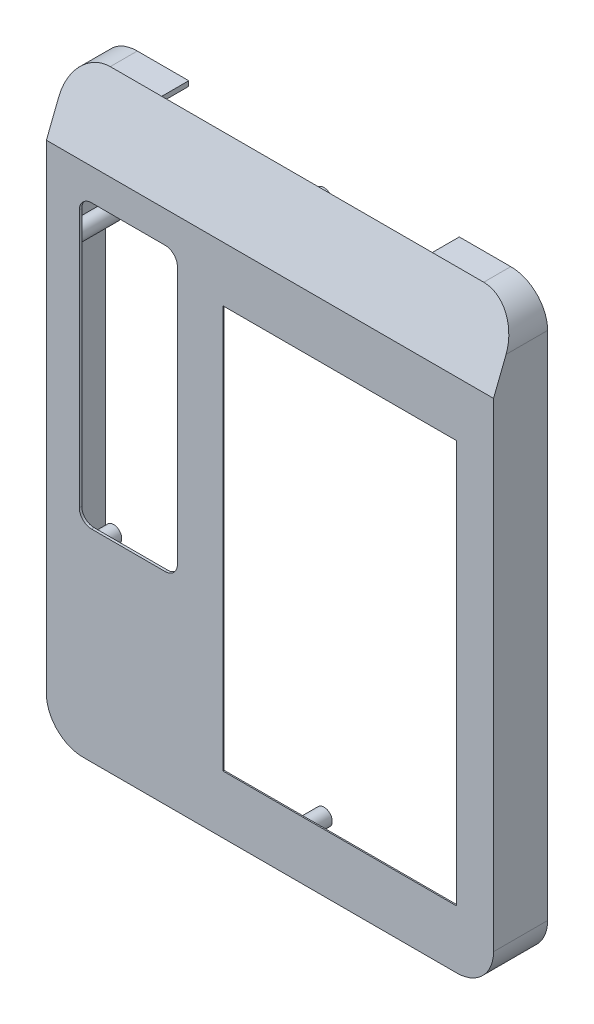
from build123d import *

# Parameters (mm, degrees)
BOSS_EXTRUDE1_DEPTH    = 22
CUT_EXTRUDE2_DEPTH     = 190.5
SHELL2_T               = -2
SKETCH5_R              = 3.35
BOSS_EXTRUDE7_DEPTH    = 20
BOSS_EXTRUDE8_REACH    = 153.413
SKETCH6_R              = 3.375
SKETCH6_R_2            = 3.3
SKETCH7_R              = 2
CUT_EXTRUDE3_DEPTH     = 4
SKETCH8_W              = 110.130223608
SKETCH8_H              = 11
CUT_EXTRUDE4_DEPTH     = 10
SKETCH9_R              = 3.325
BOSS_EXTRUDE10_DEPTH   = 20
BOSS_EXTRUDE10_2_DEPTH = 20
BOSS_EXTRUDE10_3_DEPTH = 20
BOSS_EXTRUDE10_4_DEPTH = 20
SKETCH10_R             = 2
CUT_EXTRUDE5_DEPTH     = 6
SKETCH12_W             = 95
SKETCH12_H             = 164
CUT_EXTRUDE6_DEPTH     = 10
SKETCH12_3_W           = 95
SKETCH12_3_H           = 164
CUT_EXTRUDE7_DEPTH     = 1.5
CUT_EXTRUDE8_DEPTH     = 10
CUT_EXTRUDE10_DEPTH    = 1
SKETCH14_R             = 0.9
BOSS_EXTRUDE11_DEPTH   = 4
SKETCH15_R             = 0.9
BOSS_EXTRUDE12_DEPTH   = 10


with BuildPart() as part:
    # Sketch1 → Boss-Extrude1 (new body)
    with BuildSketch(Plane.XY):
        with BuildLine():
            Line((-76, 119), (76, 119))
            ThreePointArc((76, 119), (86.606601718, 114.606601718), (91, 104))
            Line((91, 104), (91, -104))
            ThreePointArc((91, -104), (86.606601718, -114.606601718), (76, -119))
            Line((76, -119), (-76, -119))
            ThreePointArc((-76, -119), (-86.606601718, -114.606601718), (-91, -104))
            Line((-91, -104), (-91, 104))
            ThreePointArc((-91, 104), (-86.606601718, 114.606601718), (-76, 119))
        make_face()
    extrude(amount=BOSS_EXTRUDE1_DEPTH)

    # Sketch3 → Cut-Extrude2 (cut, symmetric)
    with BuildSketch(Plane.ZY.offset(91)):
        Polygon((11, 119), (22, 91.053283882), (22, 119), align=None)
    extrude(amount=CUT_EXTRUDE2_DEPTH, both=True, mode=Mode.SUBTRACT)

    # Shell2
    shell2_openings = [part.faces().sort_by_distance(p)[0] for p in [
        (0, 0, 0),
    ]]
    offset(amount=SHELL2_T, openings=shell2_openings, kind=Kind.INTERSECTION)

    # Sketch5 → Boss-Extrude7 (add)
    with BuildSketch(Plane(origin=(0, 0, 20), x_dir=(-1, 0, 0), z_dir=(0, 0, -1))):
        with Locations(Location((0, -112.875, 0), (0, 0, 180))):
            Circle(SKETCH5_R)
        with Locations(Location((-82.275572683, -110.275572683, 0), (0, 0, 180))):
            Circle(SKETCH5_R)
        with Locations(Location((82.275572683, -110.275572683, 0), (0, 0, 180))):
            Circle(SKETCH5_R)
    extrude(amount=BOSS_EXTRUDE7_DEPTH)

    # Boss-Extrude8: up to this plane
    boss_extrude8_end = Plane(origin=(99.5, 118.267487817, 9.138971816), z_dir=(0, -0.3662560913903144, -0.9305140920585189))
    # Sketch6 → Boss-Extrude8 (add, up to the surface)
    with BuildSketch(Plane(origin=(0, 0, 0), x_dir=(-1, 0, 0), z_dir=(0, 0, -1)), mode=Mode.PRIVATE) as boss_extrude8_sk1:
        with Locations((0, 105.5)):
            Circle(SKETCH6_R)
    boss_extrude8_tool1 = split(extrude(boss_extrude8_sk1.sketch, amount=-BOSS_EXTRUDE8_REACH, mode=Mode.PRIVATE), bisect_by=boss_extrude8_end, keep=Keep.BOTH, mode=Mode.PRIVATE)
    add(boss_extrude8_tool1.solids().sort_by_distance((0, 105.5, 0))[0])
    # Sketch6 → Boss-Extrude8 (add, up to the surface)
    with BuildSketch(Plane(origin=(0, 0, 0), x_dir=(-1, 0, 0), z_dir=(0, 0, -1)), mode=Mode.PRIVATE) as boss_extrude8_sk2:
        with Locations((-81.833630945, 109.833630945)):
            Circle(SKETCH6_R_2)
    boss_extrude8_tool2 = split(extrude(boss_extrude8_sk2.sketch, amount=-BOSS_EXTRUDE8_REACH, mode=Mode.PRIVATE), bisect_by=boss_extrude8_end, keep=Keep.BOTH, mode=Mode.PRIVATE)
    add(boss_extrude8_tool2.solids().sort_by_distance((81.833631, 109.833631, 0))[0])
    # Sketch6 → Boss-Extrude8 (add, up to the surface)
    with BuildSketch(Plane(origin=(0, 0, 0), x_dir=(-1, 0, 0), z_dir=(0, 0, -1)), mode=Mode.PRIVATE) as boss_extrude8_sk3:
        with Locations((81.833630945, 109.833630945)):
            Circle(SKETCH6_R_2)
    boss_extrude8_tool3 = split(extrude(boss_extrude8_sk3.sketch, amount=-BOSS_EXTRUDE8_REACH, mode=Mode.PRIVATE), bisect_by=boss_extrude8_end, keep=Keep.BOTH, mode=Mode.PRIVATE)
    add(boss_extrude8_tool3.solids().sort_by_distance((-81.833631, 109.833631, 0))[0])

    # Sketch7 → Cut-Extrude3 (cut)
    with BuildSketch(Plane(origin=(0, 0, 0), x_dir=(-1, 0, 0), z_dir=(0, 0, -1))):
        with Locations((-82.275572683, -110.275572683)):
            Circle(SKETCH7_R)
        with Locations((0, -112.875)):
            Circle(SKETCH7_R)
        with Locations((82.275572683, -110.275572683)):
            Circle(SKETCH7_R)
        with Locations((81.833630945, 109.833630945)):
            Circle(SKETCH7_R)
        with Locations((0, 105.5)):
            Circle(SKETCH7_R)
        with Locations((-81.833630945, 109.833630945)):
            Circle(SKETCH7_R)
    extrude(amount=-CUT_EXTRUDE3_DEPTH, mode=Mode.SUBTRACT)

    # Sketch8 → Cut-Extrude4 (cut)
    with BuildSketch(Plane(origin=(0, 119, 0), x_dir=(1, 0, 0), z_dir=(0, 1, 0))):
        with Locations((0, -5.5)):
            Rectangle(SKETCH8_W, SKETCH8_H)
    extrude(amount=-CUT_EXTRUDE4_DEPTH, mode=Mode.SUBTRACT)

    # Sketch12 → Cut-Extrude6 (cut)
    with BuildSketch(Plane(origin=(0, 0, 20), x_dir=(-1, 0, 0), z_dir=(0, 0, -1))):
        with Locations((-28.378679656, -13.378679656)):
            Rectangle(SKETCH12_W, SKETCH12_H)
    extrude(amount=-CUT_EXTRUDE6_DEPTH, mode=Mode.SUBTRACT)

    # Sketch12<3> → Cut-Extrude7 (cut)
    with BuildSketch(Plane(origin=(0, 0, 20), x_dir=(-1, 0, 0), z_dir=(0, 0, -1))):
        with BuildLine():
            Line((-77.878679656, 76.621320344), (24.121320344, 76.621320344))
            ThreePointArc((24.121320344, 76.621320344), (26.242640687, 75.742640687), (27.121320344, 73.621320344))
            Line((27.121320344, 73.621320344), (27.121320344, -98.378679656))
            ThreePointArc((27.121320344, -98.378679656), (26.242640687, -100.5), (24.121320344, -101.378679656))
            Line((24.121320344, -101.378679656), (-77.878679656, -101.378679656))
            ThreePointArc((-77.878679656, -101.378679656), (-80, -100.5), (-80.878679656, -98.378679656))
            Line((-80.878679656, -98.378679656), (-80.878679656, 73.621320344))
            ThreePointArc((-80.878679656, 73.621320344), (-80, 75.742640687), (-77.878679656, 76.621320344))
        make_face()
        with Locations((-28.378679656, -13.378679656)):
            Rectangle(SKETCH12_3_W, SKETCH12_3_H, mode=Mode.SUBTRACT)
    extrude(amount=-CUT_EXTRUDE7_DEPTH, mode=Mode.SUBTRACT)

    # Sketch13 → Cut-Extrude8 (cut)
    with BuildSketch(Plane(origin=(0, 0, 20), x_dir=(-1, 0, 0), z_dir=(0, 0, -1))):
        with BuildLine():
            Line((42.681051741, 78.185953944), (72.612751843, 78.185953944))
            ThreePointArc((72.612751843, 78.185953944), (76.148285749, 76.72148785), (77.612751843, 73.185953944))
            Line((77.612751843, 73.185953944), (77.612751843, -31.814046056))
            ThreePointArc((77.612751843, -31.814046056), (76.148285749, -35.349579962), (72.612751843, -36.814046056))
            Line((72.612751843, -36.814046056), (42.681051741, -36.814046056))
            ThreePointArc((42.681051741, -36.814046056), (39.145517835, -35.349579962), (37.681051741, -31.814046056))
            Line((37.681051741, -31.814046056), (37.681051741, 73.185953944))
            ThreePointArc((37.681051741, 73.185953944), (39.145517835, 76.72148785), (42.681051741, 78.185953944))
        make_face()
    extrude(amount=-CUT_EXTRUDE8_DEPTH, mode=Mode.SUBTRACT)

    # Sketch13<4> → Cut-Extrude10 (cut)
    with BuildSketch(Plane(origin=(0, 0, 20), x_dir=(-1, 0, 0), z_dir=(0, 0, -1))):
        with BuildLine():
            Line((41.760543847, 83.408237481), (73.533259737, 83.408237481))
            ThreePointArc((73.533259737, 83.408237481), (80.604327549, 80.479305293), (83.533259737, 73.408237481))
            Line((83.533259737, 73.408237481), (83.533259737, -32.036329593))
            ThreePointArc((83.533259737, -32.036329593), (80.604327549, -39.107397405), (73.533259737, -42.036329593))
            Line((73.533259737, -42.036329593), (41.760543847, -42.036329593))
            ThreePointArc((41.760543847, -42.036329593), (34.689476035, -39.107397405), (31.760543847, -32.036329593))
            Line((31.760543847, -32.036329593), (31.760543847, 73.408237481))
            ThreePointArc((31.760543847, 73.408237481), (34.689476035, 80.479305293), (41.760543847, 83.408237481))
        make_face()
        with BuildLine():
            Line((42.681051741, 78.185953944), (72.612751843, 78.185953944))
            ThreePointArc((72.612751843, 78.185953944), (76.148285749, 76.72148785), (77.612751843, 73.185953944))
            Line((77.612751843, 73.185953944), (77.612751843, -31.814046056))
            ThreePointArc((77.612751843, -31.814046056), (76.148285749, -35.349579962), (72.612751843, -36.814046056))
            Line((72.612751843, -36.814046056), (42.681051741, -36.814046056))
            ThreePointArc((42.681051741, -36.814046056), (39.145517835, -35.349579962), (37.681051741, -31.814046056))
            Line((37.681051741, -31.814046056), (37.681051741, 73.185953944))
            ThreePointArc((37.681051741, 73.185953944), (39.145517835, 76.72148785), (42.681051741, 78.185953944))
        make_face(mode=Mode.SUBTRACT)
    extrude(amount=-CUT_EXTRUDE10_DEPTH, mode=Mode.SUBTRACT)

    # Sketch14 → Boss-Extrude11 (add)
    with BuildSketch(Plane(origin=(0, 0, 20), x_dir=(-1, 0, 0), z_dir=(0, 0, -1))):
        with Locations(Location((85.021901792, -3.314046056, 0), (0, 0, 180))):
            Circle(SKETCH14_R)
        with Locations(Location((85.021901792, 44.685953944, 0), (0, 0, 180))):
            Circle(SKETCH14_R)
        with Locations(Location((30.271901792, 44.685953944, 0), (0, 0, 180))):
            Circle(SKETCH14_R)
        with Locations(Location((57.646901792, 85.060953944, 0), (0, 0, 180))):
            Circle(SKETCH14_R)
        with Locations(Location((30.271901792, -3.314046056, 0), (0, 0, 180))):
            Circle(SKETCH14_R)
        with Locations(Location((57.646901792, -43.689046056, 0), (0, 0, 180))):
            Circle(SKETCH14_R)
    extrude(amount=BOSS_EXTRUDE11_DEPTH)

    # Sketch15 → Boss-Extrude12 (add)
    with BuildSketch(Plane(origin=(0, 0, 20), x_dir=(-1, 0, 0), z_dir=(0, 0, -1))):
        with Locations(Location((35.040591128, -94.277720483, 0), (0, 0, 180))):
            Circle(SKETCH15_R)
        with Locations(Location((35.040591128, -48.53430384, 0), (0, 0, 180))):
            Circle(SKETCH15_R)
        with Locations(Location((6.665591128, 79.077279517, 0), (0, 0, 180))):
            Circle(SKETCH15_R)
        with Locations(Location((-58.584408872, 79.077279517, 0), (0, 0, 180))):
            Circle(SKETCH15_R)
        with Locations(Location((-81.959408872, 70.202279517, 0), (0, 0, 180))):
            Circle(SKETCH15_R)
        with Locations(Location((-81.959408872, -94.277720483, 0), (0, 0, 180))):
            Circle(SKETCH15_R)
    extrude(amount=BOSS_EXTRUDE12_DEPTH)


with BuildPart() as body_2:
    # Sketch9 → Boss-Extrude10 (new body)
    with BuildSketch(Plane(origin=(0, 0, 0), x_dir=(-1, 0, 0), z_dir=(0, 0, -1))):
        with Locations((-85.675, 57.95280878)):
            Circle(SKETCH9_R)
    extrude(amount=-BOSS_EXTRUDE10_DEPTH)


with BuildPart() as body_3:
    # Sketch9 → Boss-Extrude10 2 (new body)
    with BuildSketch(Plane(origin=(0, 0, 0), x_dir=(-1, 0, 0), z_dir=(0, 0, -1))):
        with Locations(Location((85.675, 57.95280878, 0), (0, 0, 180))):
            Circle(SKETCH9_R)
    extrude(amount=-BOSS_EXTRUDE10_2_DEPTH)


with BuildPart() as body_4:
    # Sketch9 → Boss-Extrude10 3 (new body)
    with BuildSketch(Plane(origin=(0, 0, 0), x_dir=(-1, 0, 0), z_dir=(0, 0, -1))):
        with Locations(Location((-85.675, -56.04719122, 0), (0, 0, 180))):
            Circle(SKETCH9_R)
    extrude(amount=-BOSS_EXTRUDE10_3_DEPTH)


with BuildPart() as body_5:
    # Sketch9 → Boss-Extrude10 4 (new body)
    with BuildSketch(Plane(origin=(0, 0, 0), x_dir=(-1, 0, 0), z_dir=(0, 0, -1))):
        with Locations((85.675, -56.04719122)):
            Circle(SKETCH9_R)
    extrude(amount=-BOSS_EXTRUDE10_4_DEPTH)


with BuildPart() as cut_extrude5_tool:
    # Sketch10 → Cut-Extrude5 (new body)
    with BuildSketch(Plane(origin=(0, 0, 0), x_dir=(-1, 0, 0), z_dir=(0, 0, -1))):
        with Locations((-85.675, 57.95280878)):
            Circle(SKETCH10_R)
        with Locations((-85.675, -56.04719122)):
            Circle(SKETCH10_R)
        with Locations((85.675, -56.04719122)):
            Circle(SKETCH10_R)
        with Locations((85.675, 57.95280878)):
            Circle(SKETCH10_R)
    extrude(amount=-CUT_EXTRUDE5_DEPTH)


with BuildPart() as body_2_1:
    add(body_2.part)

    # Cut-Extrude5: cut by cut_extrude5_tool
    add(cut_extrude5_tool.part, mode=Mode.SUBTRACT)


with BuildPart() as body_3_1:
    add(body_3.part)

    # Cut-Extrude5: cut by cut_extrude5_tool
    add(cut_extrude5_tool.part, mode=Mode.SUBTRACT)


with BuildPart() as body_4_1:
    add(body_4.part)

    # Cut-Extrude5: cut by cut_extrude5_tool
    add(cut_extrude5_tool.part, mode=Mode.SUBTRACT)


with BuildPart() as body_5_1:
    add(body_5.part)

    # Cut-Extrude5: cut by cut_extrude5_tool
    add(cut_extrude5_tool.part, mode=Mode.SUBTRACT)


solid = Compound([part.part, body_2_1.part, body_3_1.part, body_4_1.part, body_5_1.part])
